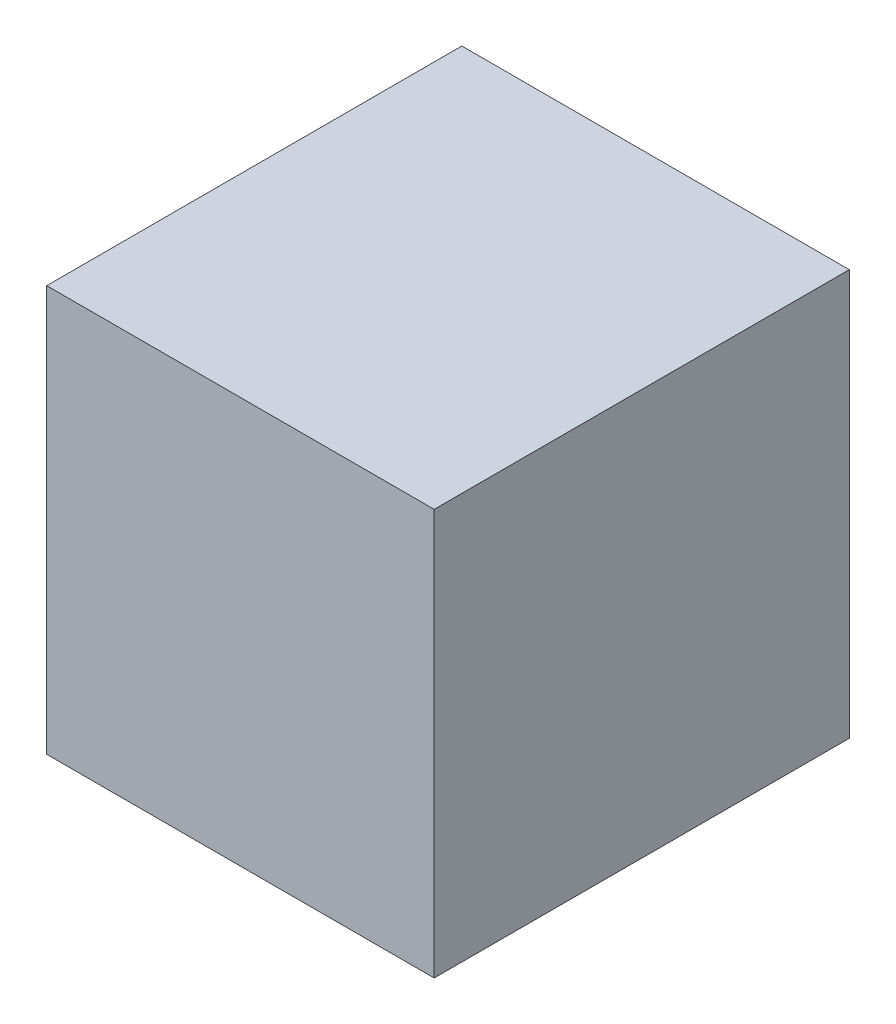
from build123d import *

# Parameters (mm, degrees)
SKETCH1_W           = 84
SKETCH1_H           = 90
BOSS_EXTRUDE1_DEPTH = 88


with BuildPart() as part:
    # Sketch1 → Boss-Extrude1 (new body)
    with BuildSketch(Plane(origin=(0, 0, 0), x_dir=(1, 0, 0), z_dir=(0, 1, 0))):
        Rectangle(SKETCH1_W, SKETCH1_H)
    extrude(amount=BOSS_EXTRUDE1_DEPTH)


solid = part.part
